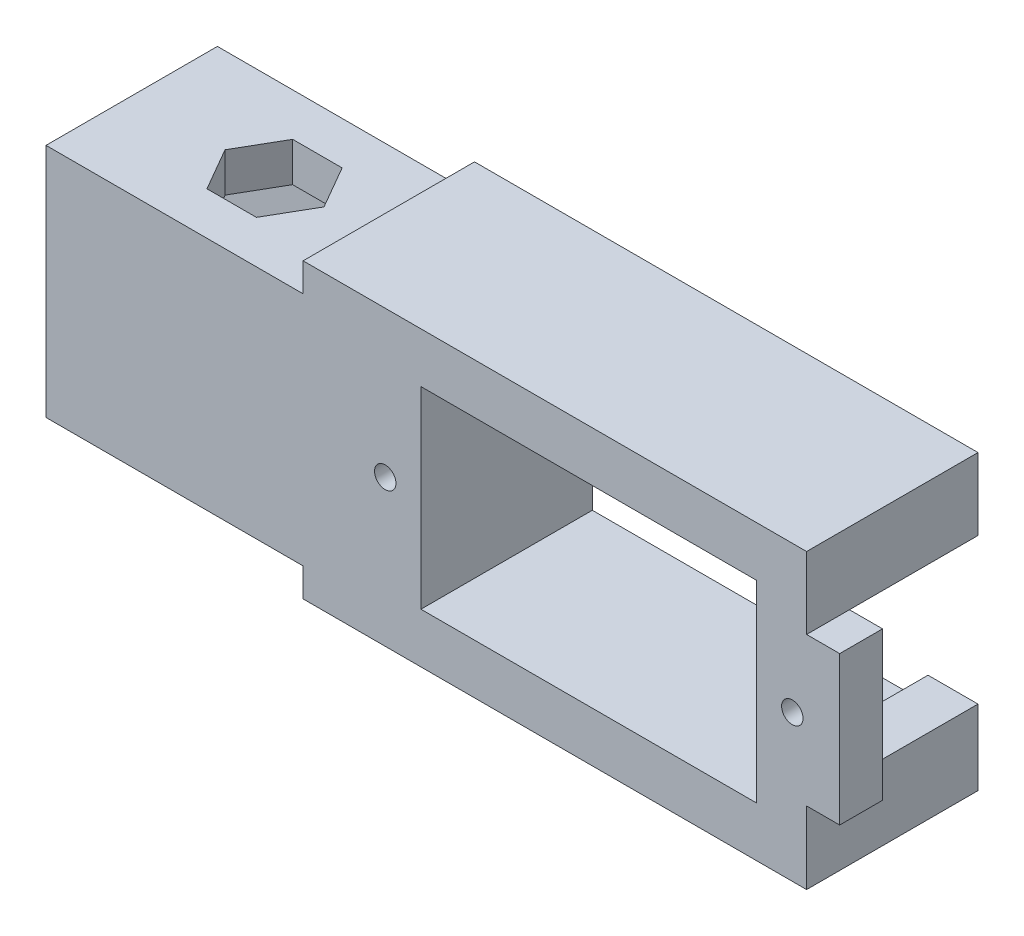
from build123d import *

# Parameters (mm, degrees)
SKETCH_2_W           = 30.5
SKETCH_2_H           = 20.5
SKETCH_2_W_2         = 22.5
SKETCH_2_H_2         = 12.5
EXTRUDE_1_DEPTH      = 12
SKETCH_3_W           = 2.75
SKETCH_3_H           = 10
EXTRUDE_2_DEPTH      = 3
SKETCH_4_W           = 4.940698383
SKETCH_4_H           = 10
CUT_EXTRUDE_1_DEPTH  = 9
EXTRUDE_3_DEPTH      = 20
EXTRUDE_4_REACH      = 38.805
SKETCH_7_R           = 0.75
CUT_EXTRUDE_2_DEPTH  = 41.374032496
SKETCH_8_W           = 10
SKETCH_8_H           = 10
CUT_EXTRUDE_3_DEPTH  = 18
SKETCH_10_W          = 23.106147985
SKETCH_10_H          = 7.754593222
CUT_EXTRUDE_4_DEPTH  = 42.146840705
SKETCH_11_R          = 1.5
CUT_EXTRUDE_5_DEPTH  = 44.934610502
CUT_EXTRUDE_6_REACH  = 60.181
SKETCH_12_W          = 11
SKETCH_12_H          = 11
SKETCH_13_W          = 23.5
SKETCH_13_H          = 13.5
CUT_EXTRUDE_7_DEPTH  = 42.146840705
SKETCH_14_W          = 9.129424231
SKETCH_14_H          = 10.218893611
CUT_EXTRUDE_8_DEPTH  = 42.146840705
CUT_EXTRUDE_9_REACH  = 45.935
CUT_EXTRUDE_10_REACH = 43.147
SKETCH_16_R          = 1.5
SKETCH_17_W          = 5.816970736
SKETCH_17_H          = 10.394960723
EXTRUDE_5_DEPTH      = 3


with BuildPart() as part:
    # 草图2 → 凸台-拉伸1 (new body)
    with BuildSketch(Plane.XY):
        Rectangle(SKETCH_2_W, SKETCH_2_H)
        Rectangle(SKETCH_2_W_2, SKETCH_2_H_2, mode=Mode.SUBTRACT)
    extrude(amount=EXTRUDE_1_DEPTH)

    # 草图3 → 凸台-拉伸2 (add)
    with BuildSketch(Plane.XY.offset(12)):
        with Locations((-16.625, 0)):
            Rectangle(SKETCH_3_W, SKETCH_3_H)
    extrude_2 = extrude(amount=-EXTRUDE_2_DEPTH)

    # 镜向1: 凸台-拉伸2 across plane
    add(extrude_2.mirror(Plane(origin=(0, 0, 0), x_dir=(0, 0, 1), z_dir=(1, 0, 0))))

    # 草图4 → 切除-拉伸1 (cut)
    with BuildSketch(Plane(origin=(0, 0, 0), x_dir=(-1, 0, 0), z_dir=(0, 0, -1))):
        with Locations((15.220349192, 0)):
            Rectangle(SKETCH_4_W, SKETCH_4_H)
    cut_extrude_1 = extrude(amount=-CUT_EXTRUDE_1_DEPTH, mode=Mode.SUBTRACT)

    # 镜向2: 切除-拉伸1 across plane
    add(cut_extrude_1.mirror(Plane(origin=(0, 0, 0), x_dir=(0, 0, 1), z_dir=(1, 0, 0))), mode=Mode.SUBTRACT)

    # 草图5 → 凸台-拉伸3 (add)
    with BuildSketch(Plane.ZY.offset(18)):
        Polygon((12, 10.25), (12, 5), (12, -5), (12, -10.25), (0, -10.25), (0, -5), (0, 5), (0, 10.25), align=None)
    extrude(amount=EXTRUDE_3_DEPTH)

    # 草图6 → 凸台-拉伸4 (add, up to next)
    with BuildSketch(Plane.ZY.offset(15.25), mode=Mode.PRIVATE) as extrude_4_sk1:
        Polygon((12, -5), (9, -5), (0, -5), (0, -10.25), (12, -10.25), align=None)
    extrude_4_tool1 = extrude(extrude_4_sk1.sketch, amount=EXTRUDE_4_REACH, mode=Mode.PRIVATE) - part.part
    extrude_4 = extrude_4_tool1.solids().sort_by_distance((-15.25, -7.625, 6))[0]
    add(extrude_4)

    # 镜向3: 凸台-拉伸4 across plane
    add(extrude_4.mirror(Plane.ZX))

    # 草图7 → 切除-拉伸2 (cut, through all)
    with BuildSketch(Plane(origin=(0, 0, 9), x_dir=(-1, 0, 0), z_dir=(0, 0, -1))):
        with Locations((14.25, 0)):
            Circle(SKETCH_7_R)
    cut_extrude_2 = extrude(amount=-CUT_EXTRUDE_2_DEPTH, mode=Mode.SUBTRACT)

    # 草图8 → 切除-拉伸3 (cut)
    with BuildSketch(Plane.ZY.offset(38)):
        with Locations((6, 0)):
            Rectangle(SKETCH_8_W, SKETCH_8_H)
    extrude(amount=-CUT_EXTRUDE_3_DEPTH, mode=Mode.SUBTRACT)

    # 草图10 → 切除-拉伸4 (cut, through all)
    with BuildSketch(Plane(origin=(0, 0, 0), x_dir=(-1, 0, 0), z_dir=(0, 0, -1))):
        with Locations((31.553073992, 12.127296611)):
            Rectangle(SKETCH_10_W, SKETCH_10_H)
    cut_extrude_4 = extrude(amount=-CUT_EXTRUDE_4_DEPTH, mode=Mode.SUBTRACT)

    # 镜向4: 切除-拉伸4 across plane
    add(cut_extrude_4.mirror(Plane.ZX), mode=Mode.SUBTRACT)

    # 草图11 → 切除-拉伸5 (cut, through all)
    with BuildSketch(Plane.XZ.offset(8.25)):
        with Locations(Location((-28, 6, 0), (0, 0, 270))):
            Circle(SKETCH_11_R)
    extrude(amount=-CUT_EXTRUDE_5_DEPTH, mode=Mode.SUBTRACT)

    # 镜向5: 切除-拉伸2 across plane
    add(cut_extrude_2.mirror(Plane(origin=(0, 0, 0), x_dir=(0, 0, 1), z_dir=(1, 0, 0))), mode=Mode.SUBTRACT)

    # 切除-拉伸6: up to this face of the body (flat: up to its plane)
    cut_extrude_6_end = Plane(part.part.faces().sort_by_distance((-20, 0, 6))[0])
    # 草图12 → 切除-拉伸6 (cut, up to the picked face)
    with BuildSketch(Plane.ZY.offset(38), mode=Mode.PRIVATE) as cut_extrude_6_sk1:
        with Locations((6, 0)):
            Rectangle(SKETCH_12_W, SKETCH_12_H)
    cut_extrude_6_tool1 = split(extrude(cut_extrude_6_sk1.sketch, amount=-CUT_EXTRUDE_6_REACH, mode=Mode.PRIVATE), bisect_by=cut_extrude_6_end, keep=Keep.BOTH, mode=Mode.PRIVATE)
    add(cut_extrude_6_tool1.solids().sort_by(Axis((-38, 0, 6), (1, 0, 0)))[0], mode=Mode.SUBTRACT)

    # 草图13 → 切除-拉伸7 (cut, through all)
    with BuildSketch(Plane.XY.offset(12)):
        Rectangle(SKETCH_13_W, SKETCH_13_H)
    extrude(amount=-CUT_EXTRUDE_7_DEPTH, mode=Mode.SUBTRACT)

    # 草图14 → 切除-拉伸8 (cut, through all)
    with BuildSketch(Plane.XY.offset(12)):
        with Locations((13.435287884, 0.109446806)):
            Rectangle(SKETCH_14_W, SKETCH_14_H)
    extrude(amount=-CUT_EXTRUDE_8_DEPTH, mode=Mode.SUBTRACT)

    # 草图15 → 切除-拉伸9 (cut, up to next)
    with BuildSketch(Plane(origin=(0, 8.25, 0), x_dir=(1, 0, 0), z_dir=(0, 1, 0)), mode=Mode.PRIVATE) as cut_extrude_9_sk1:
        Polygon((-24.535898385, -6), (-26.267949192, -3), (-29.732050808, -3), (-31.464101615, -6), (-29.732050808, -9), (-26.267949192, -9), align=None)
    cut_extrude_9_tool1 = extrude(cut_extrude_9_sk1.sketch, amount=-CUT_EXTRUDE_9_REACH, mode=Mode.PRIVATE) & part.part
    add(cut_extrude_9_tool1.solids().sort_by_distance((-28, 8.25, 6))[0], mode=Mode.SUBTRACT)

    # 草图16 → 切除-拉伸10 (cut, up to next)
    with BuildSketch(Plane(origin=(0, 0, 0), x_dir=(-1, 0, 0), z_dir=(0, 0, -1)), mode=Mode.PRIVATE) as cut_extrude_10_sk1:
        with Locations((28, 0)):
            Circle(SKETCH_16_R)
    cut_extrude_10_tool1 = extrude(cut_extrude_10_sk1.sketch, amount=-CUT_EXTRUDE_10_REACH, mode=Mode.PRIVATE) & part.part
    add(cut_extrude_10_tool1.solids().sort_by_distance((-28, 0, 0))[0], mode=Mode.SUBTRACT)

    # 草图17 → 凸台-拉伸5 (add)
    with BuildSketch(Plane.XY.offset(12)):
        with Locations((14.658485368, 0.02141325)):
            Rectangle(SKETCH_17_W, SKETCH_17_H)
    extrude(amount=-EXTRUDE_5_DEPTH)

    # 镜向6: 切除-拉伸2 across plane
    add(cut_extrude_2.mirror(Plane.ZY), mode=Mode.SUBTRACT)


solid = part.part
